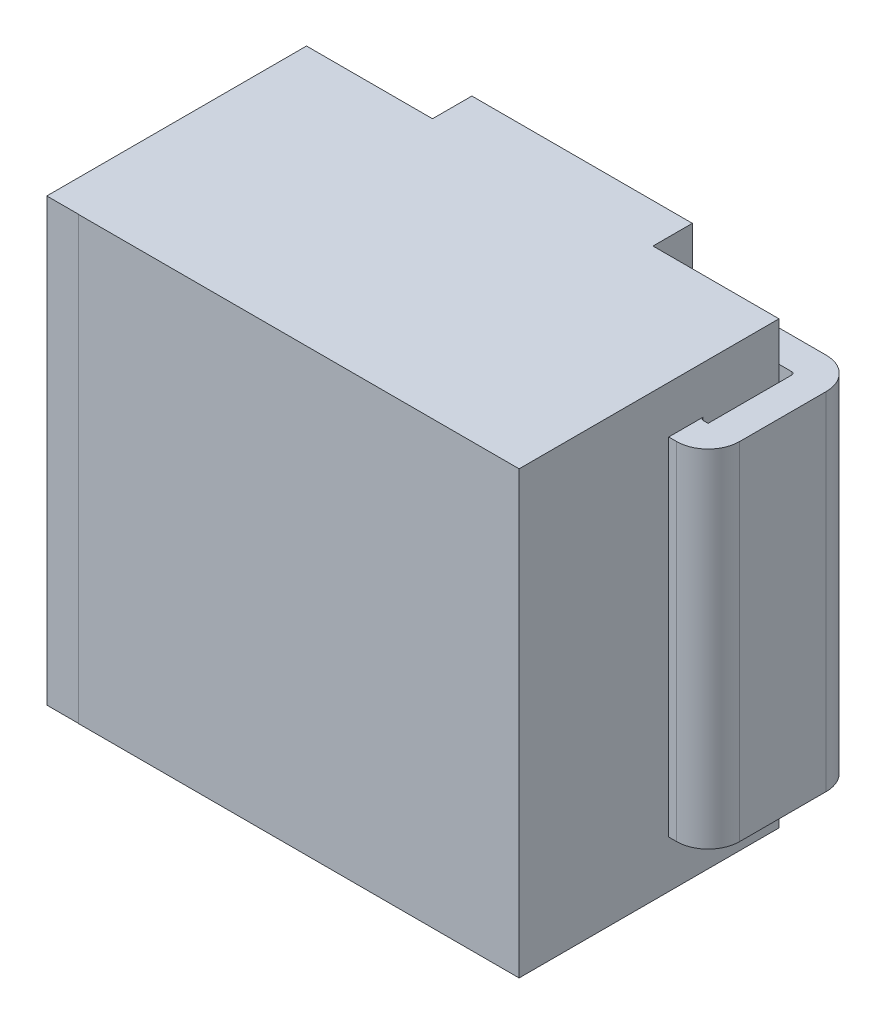
from build123d import *

# Parameters (mm, degrees)
SKETCH_1_W          = 3.5
SKETCH_1_H          = 2.8
EXTRUDE_1_DEPTH     = 1.9
CUT_EXTRUDE_2_REACH = 24.342
SKETCH_3_W          = 0.25
SKETCH_3_H          = 0.95
SKETCH_4_W          = 0.95
SKETCH_4_H          = 0.3
CUT_EXTRUDE_3_DEPTH = 0.25
SKETCH_5_W          = 0.95
SKETCH_5_H          = 0.3
CUT_EXTRUDE_4_DEPTH = 0.25
SKETCH_6_W          = 0.05
SKETCH_6_H          = 0.25
CUT_EXTRUDE_5_DEPTH = 23.342392493
SKETCH_7_W          = 0.75
SKETCH_7_H          = 0.3
CUT_EXTRUDE_6_DEPTH = 0.25
FILLET_1_R          = 0.2
CUT_EXTRUDE_7_DEPTH = 23.342392493
FILLET_2_R          = 0.02
SKETCH_9_W          = 0.203467288
SKETCH_9_H          = 2.8
CUT_EXTRUDE_8_DEPTH = 0.001


with BuildPart() as part:
    # 草图1 → 凸台-拉伸1 (new body)
    with BuildSketch(Plane.XY):
        with Locations((-20.334666678, -11.310599527)):
            Rectangle(SKETCH_1_W, SKETCH_1_H)
    extrude(amount=EXTRUDE_1_DEPTH)

    # 草图3 → 切除-拉伸2 (cut, up to next)
    with BuildSketch(Plane.XZ.offset(12.710599527), mode=Mode.PRIVATE) as cut_extrude_2_sk1:
        with Locations((-21.959666678, 1.425)):
            Rectangle(SKETCH_3_W, SKETCH_3_H)
    cut_extrude_2_tool1 = extrude(cut_extrude_2_sk1.sketch, amount=-CUT_EXTRUDE_2_REACH, mode=Mode.PRIVATE) & part.part
    # 草图3 → 切除-拉伸2 (cut, up to next)
    with BuildSketch(Plane.XZ.offset(12.710599527), mode=Mode.PRIVATE) as cut_extrude_2_sk2:
        with Locations((-18.709666678, 1.425)):
            Rectangle(SKETCH_3_W, SKETCH_3_H)
    cut_extrude_2_tool2 = extrude(cut_extrude_2_sk2.sketch, amount=-CUT_EXTRUDE_2_REACH, mode=Mode.PRIVATE) & part.part
    add(cut_extrude_2_tool1.solids().sort_by_distance((-21.959667, -12.7106, 1.425))[0], mode=Mode.SUBTRACT)
    add(cut_extrude_2_tool2.solids().sort_by_distance((-18.709667, -12.7106, 1.425))[0], mode=Mode.SUBTRACT)

    # 草图4 → 切除-拉伸3 (cut)
    with BuildSketch(Plane.ZY.offset(22.084666678)):
        with Locations((0.475, -12.560599527)):
            Rectangle(SKETCH_4_W, SKETCH_4_H)
        with Locations((0.475, -10.060599527)):
            Rectangle(SKETCH_4_W, SKETCH_4_H)
    extrude(amount=-CUT_EXTRUDE_3_DEPTH, mode=Mode.SUBTRACT)

    # 草图5 → 切除-拉伸4 (cut)
    with BuildSketch(Plane(origin=(-18.584666678, 0, 0), x_dir=(0, 0, -1), z_dir=(1, 0, 0))):
        with Locations((-0.475, -10.060599527)):
            Rectangle(SKETCH_5_W, SKETCH_5_H)
        with Locations((-0.475, -12.560599527)):
            Rectangle(SKETCH_5_W, SKETCH_5_H)
    extrude(amount=-CUT_EXTRUDE_4_DEPTH, mode=Mode.SUBTRACT)

    # 草图6 → 切除-拉伸5 (cut, through all)
    with BuildSketch(Plane.XZ.offset(12.710599527)):
        with Locations((-19.609666678, 0.125)):
            Rectangle(SKETCH_6_W, SKETCH_6_H)
        with Locations((-21.059666678, 0.125)):
            Rectangle(SKETCH_6_W, SKETCH_6_H)
    extrude(amount=-CUT_EXTRUDE_5_DEPTH, mode=Mode.SUBTRACT)

    # 草图7 → 切除-拉伸6 (cut)
    with BuildSketch(Plane(origin=(0, 0, 0), x_dir=(-1, 0, 0), z_dir=(0, 0, -1))):
        with Locations((19.209666678, -12.560599527)):
            Rectangle(SKETCH_7_W, SKETCH_7_H)
        with Locations((21.459666678, -12.560599527)):
            Rectangle(SKETCH_7_W, SKETCH_7_H)
        with Locations((19.209666678, -10.060599527)):
            Rectangle(SKETCH_7_W, SKETCH_7_H)
        with Locations((21.459666678, -10.060599527)):
            Rectangle(SKETCH_7_W, SKETCH_7_H)
    extrude(amount=-CUT_EXTRUDE_6_DEPTH, mode=Mode.SUBTRACT)

    # 圆角1
    fillet_1_edges = [part.edges().sort_by_distance(p)[0] for p in [
        (-22.084666678, -11.310599527, 0.95),
        (-22.084666678, -11.310599527, 0),
        (-18.584666678, -11.310599527, 0.95),
        (-18.584666678, -11.310599527, 0),
    ]]
    fillet(fillet_1_edges, radius=FILLET_1_R)

    # 草图8 → 切除-拉伸7 (cut, through all)
    with BuildSketch(Plane.XZ.offset(12.710599527)):
        Polygon((-21.084666678, 0.2), (-21.884666678, 0.2), (-21.884666678, 0.75), (-21.834666678, 0.75), (-21.834666678, 0.25), (-21.084666678, 0.25), align=None)
        Polygon((-19.584666678, 0.25), (-19.584666678, 0.2), (-18.784666678, 0.2), (-18.784666678, 0.75), (-18.834666678, 0.75), (-18.834666678, 0.25), align=None)
    extrude(amount=-CUT_EXTRUDE_7_DEPTH, mode=Mode.SUBTRACT)

    # 圆角2
    fillet_2_edges = [part.edges().sort_by_distance(p)[0] for p in [
        (-21.884666678, -11.310599527, 0.2),
        (-21.884666678, -11.310599527, 0.75),
        (-18.834666678, -11.310599527, 0.75),
        (-18.784666678, -11.310599527, 0.2),
    ]]
    fillet(fillet_2_edges, radius=FILLET_2_R)

    # 草图9 → 切除-拉伸8 (cut)
    with BuildSketch(Plane.XY.offset(1.9)):
        with Locations((-21.732933034, -11.310599527)):
            Rectangle(SKETCH_9_W, SKETCH_9_H)
    extrude(amount=-CUT_EXTRUDE_8_DEPTH, mode=Mode.SUBTRACT)


solid = part.part
